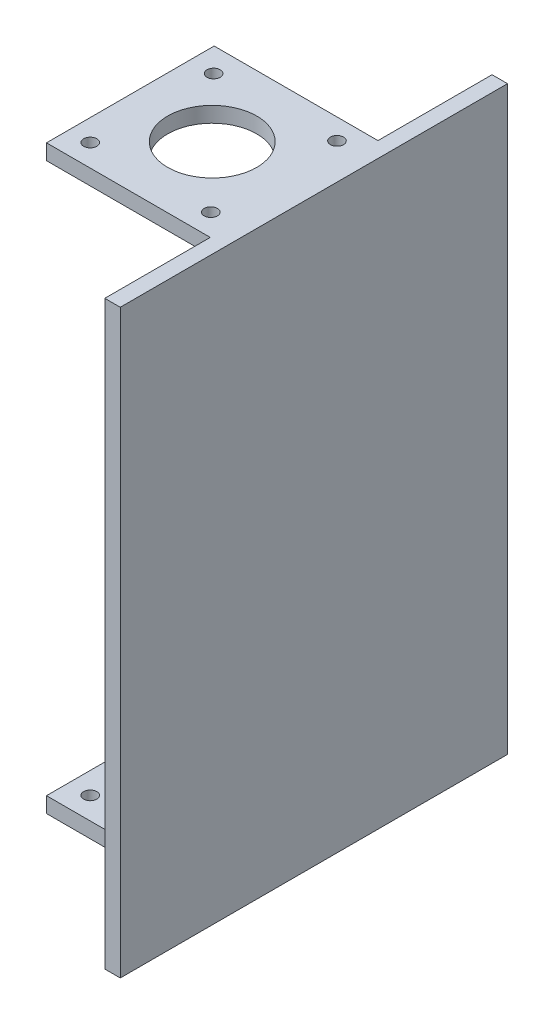
from build123d import *

# Parameters (mm, degrees)
SKETCH2_W           = 42.3
SKETCH2_H           = 43.3
SKETCH2_R           = 1.7
SKETCH2_R_2         = 11.5
BOSS_EXTRUDE1_DEPTH = 4
SKETCH10_W          = 100
SKETCH10_H          = 150
BOSS_EXTRUDE3_DEPTH = 4


with BuildPart() as part:
    # Sketch2 → Boss-Extrude1 (new body)
    with BuildSketch(Plane(origin=(0, 0, 0), x_dir=(1, 0, 0), z_dir=(0, 1, 0))):
        Rectangle(SKETCH2_W, SKETCH2_H)
        with Locations(Location((-15.069374363, 15.425624348, 0), (0, 0, 270))):
            Circle(SKETCH2_R, mode=Mode.SUBTRACT)
        with Locations(Location((15.918439372, 16.294761816, 0), (0, 0, 270))):
            Circle(SKETCH2_R, mode=Mode.SUBTRACT)
        with Locations(Location((15.566385671, -15.934385332, 0), (0, 0, 270))):
            Circle(SKETCH2_R, mode=Mode.SUBTRACT)
        with Locations(Location((-15.566385671, -15.934385332, 0), (0, 0, 270))):
            Circle(SKETCH2_R, mode=Mode.SUBTRACT)
        with Locations(Location((0, 0, 0), (0, 0, 270))):
            Circle(SKETCH2_R_2, mode=Mode.SUBTRACT)
    boss_extrude1 = extrude(amount=BOSS_EXTRUDE1_DEPTH)

    # Sketch10 → Boss-Extrude3 (add)
    with BuildSketch(Plane(origin=(21.15, 4, 21.65), x_dir=(0, 0, -1), z_dir=(1, 0, 0))):
        with Locations((22.755859724, -75)):
            Rectangle(SKETCH10_W, SKETCH10_H)
    extrude(amount=BOSS_EXTRUDE3_DEPTH)

    # Mirror3: Boss-Extrude1 across plane
    add(boss_extrude1.mirror(Plane(origin=(0, -71, 0), x_dir=(0, 0, 1), z_dir=(0, -1, 0))))


solid = part.part
